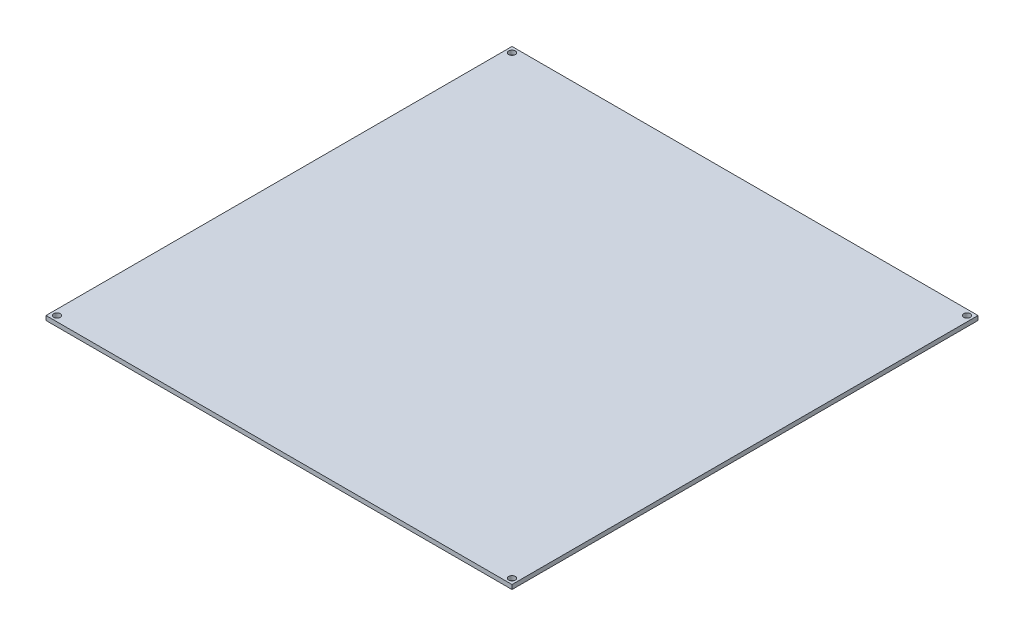
from build123d import *

# Parameters (mm, degrees)
SKICA1_W                = 214
SKICA1_H                = 214
SKICA1_R                = 1.5
P_IDAT_VYSUNUT_M1_DEPTH = 2


with BuildPart() as part:
    # Skica1 → Přidat vysunutím1 (new body)
    with BuildSketch(Plane(origin=(0, 0, 0), x_dir=(1, 0, 0), z_dir=(0, 1, 0))):
        Rectangle(SKICA1_W, SKICA1_H)
        with Locations(Location((104.5, 104.5, 0), (0, 0, 270))):
            Circle(SKICA1_R, mode=Mode.SUBTRACT)
        with Locations(Location((-104.5, 104.5, 0), (0, 0, 270))):
            Circle(SKICA1_R, mode=Mode.SUBTRACT)
        with Locations(Location((-104.5, -104.5, 0), (0, 0, 270))):
            Circle(SKICA1_R, mode=Mode.SUBTRACT)
        with Locations(Location((104.5, -104.5, 0), (0, 0, 270))):
            Circle(SKICA1_R, mode=Mode.SUBTRACT)
    extrude(amount=P_IDAT_VYSUNUT_M1_DEPTH)


solid = part.part
